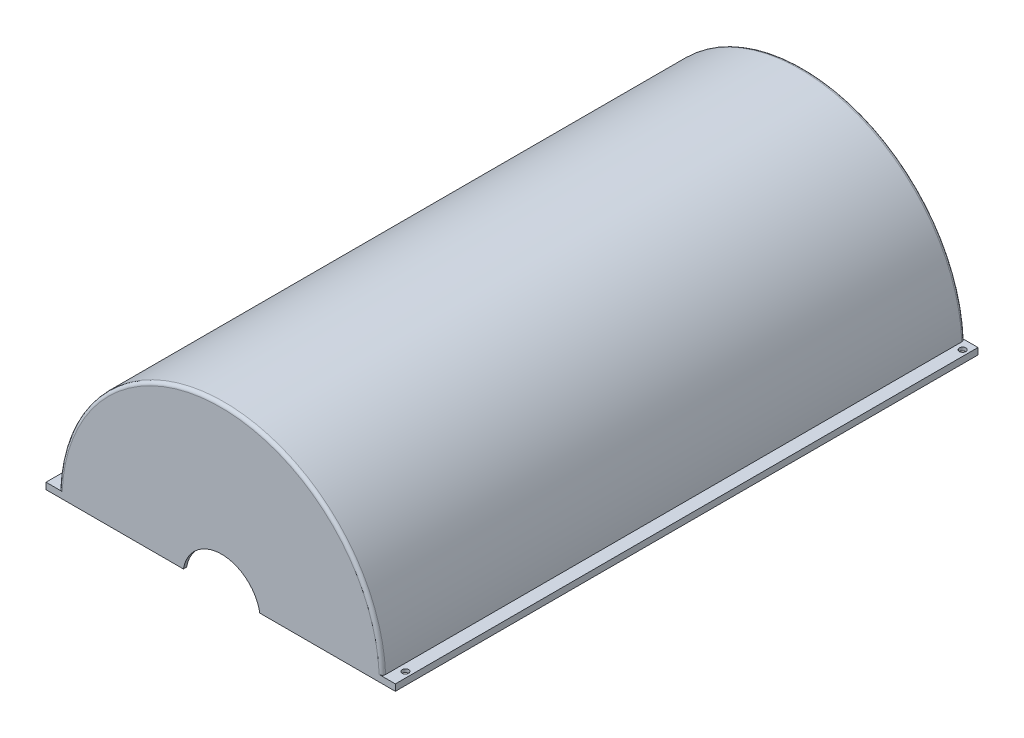
from build123d import *

# Parameters (mm, degrees)
BOSS_EXTRUDE1_DEPTH = 1800
BOSS_EXTRUDE2_DEPTH = 1800
SHELL1_T            = -10
FILLET1_R           = 10
SKETCH3_R           = 10
CUT_EXTRUDE1_DEPTH  = 2134.346626248


with BuildPart() as part:
    # Sketch1 → Boss-Extrude1 (new body)
    with BuildSketch(Plane.XY):
        with BuildLine():
            Line((0, 0), (384.757529665, 0))
            ThreePointArc((384.757529665, 0), (502.844648307, 98.659137532), (620.931766949, 0))
            Line((620.931766949, 0), (1000, 0))
            ThreePointArc((1000, 0), (500, 500), (0, 0))
        make_face()
    extrude(amount=BOSS_EXTRUDE1_DEPTH)

    # Sketch2 → Boss-Extrude2 (add)
    with BuildSketch(Plane.XY):
        Polygon((1000, 0), (1039.599839872, 0), (1039.599839872, 20), (999.599839872, 20), align=None)
        Polygon((0, 0), (-39.599839872, 0), (-39.599839872, 20), (0.400160128, 20), align=None)
    extrude(amount=BOSS_EXTRUDE2_DEPTH)

    # Shell1
    shell1_openings = [part.faces().sort_by_distance(p)[0] for p in [
        (830.265803411, 0, 900),
        (502.844648307, 98.659137532, 900),
        (172.578844897, 0, 900),
    ]]
    offset(amount=SHELL1_T, openings=shell1_openings, kind=Kind.INTERSECTION)

    # Fillet1
    fillet1_edges = [part.edges().sort_by_distance(p)[0] for p in [
        (500, 500, 0),
        (500, 500, 1800),
    ]]
    fillet(fillet1_edges, radius=FILLET1_R)

    # Sketch3 → Cut-Extrude1 (cut, through all)
    with BuildSketch(Plane(origin=(0, 20, 0), x_dir=(1, 0, 0), z_dir=(0, 1, 0))):
        with Locations(Location((-18.235719302, -19.68953089, 0), (0, 0, 180))):
            Circle(SKETCH3_R)
        with Locations(Location((1021.817467904, -29.68953089, 0), (0, 0, 180))):
            Circle(SKETCH3_R)
        with Locations(Location((1021.817467904, -1751.208740349, 0), (0, 0, 180))):
            Circle(SKETCH3_R)
        with Locations(Location((-18.235719302, -1741.208740349, 0), (0, 0, 180))):
            Circle(SKETCH3_R)
    extrude(amount=-CUT_EXTRUDE1_DEPTH, mode=Mode.SUBTRACT)


solid = part.part
